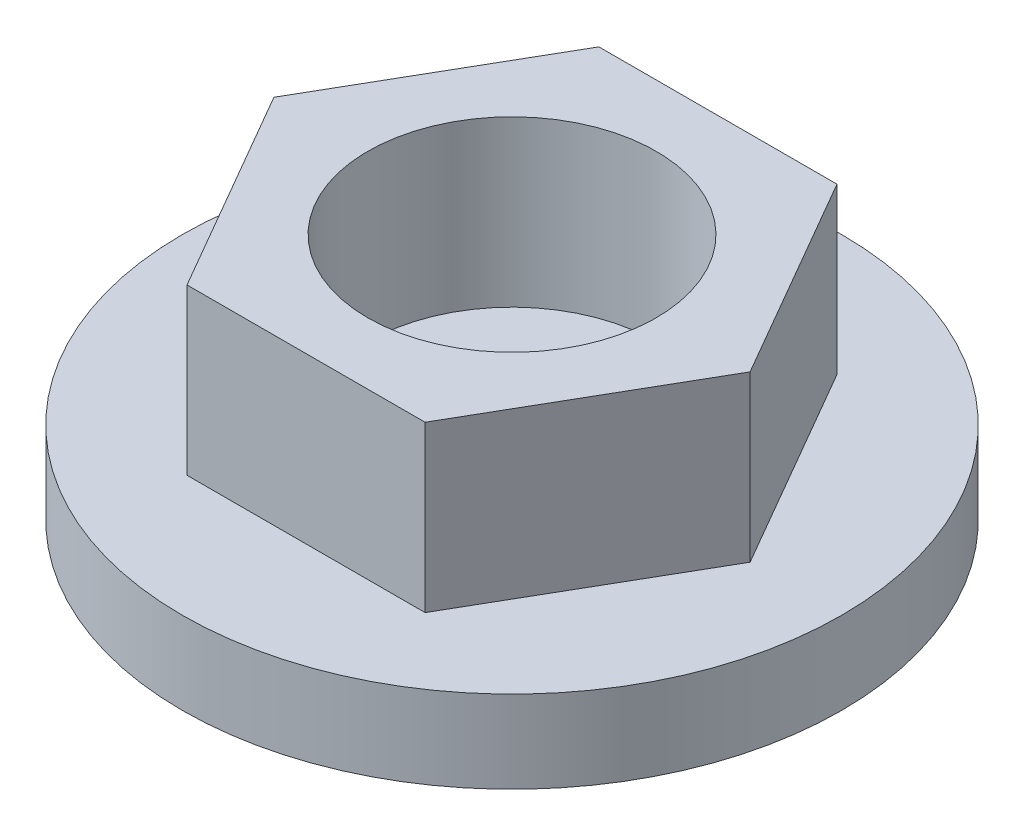
from build123d import *

# Parameters (mm, degrees)
CROQUIS1_R              = 4
SALIENTE_EXTRUIR2_DEPTH = 1
CROQUIS2_R              = 1.75
SALIENTE_EXTRUIR3_DEPTH = 2


with BuildPart() as part:
    # Croquis1 → Saliente-Extruir2 (new body)
    with BuildSketch(Plane(origin=(0, 0, 0), x_dir=(1, 0, 0), z_dir=(0, 1, 0))):
        with Locations(Location((0, 0, 0), (0, 0, 270))):
            Circle(CROQUIS1_R)
    extrude(amount=SALIENTE_EXTRUIR2_DEPTH)

    # Croquis2 → Saliente-Extruir3 (add)
    with BuildSketch(Plane(origin=(0, 1, 0), x_dir=(1, 0, 0), z_dir=(0, 1, 0))):
        Polygon((1.44192427, 2.500837406), (-1.444826589, 2.499161751), (-2.88675086, -0.001675655), (-1.44192427, -2.500837406), (1.444826589, -2.499161751), (2.88675086, 0.001675655), align=None)
        with Locations(Location((0, 0, 0), (0, 0, 270))):
            Circle(CROQUIS2_R, mode=Mode.SUBTRACT)
    extrude(amount=SALIENTE_EXTRUIR3_DEPTH)


solid = part.part
